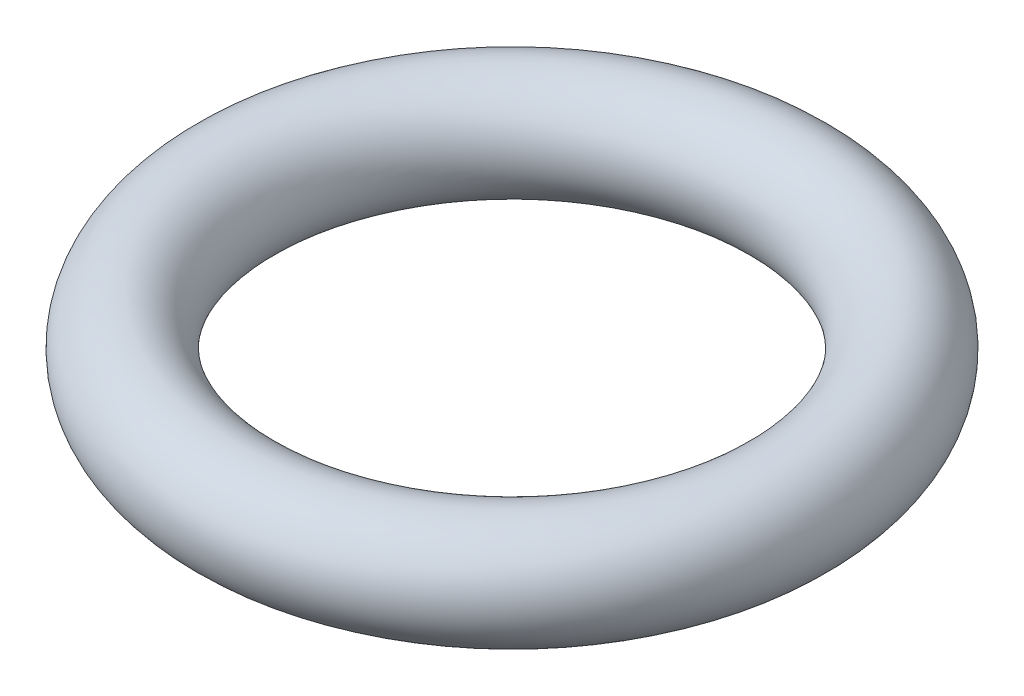
from build123d import *

# Parameters (mm, degrees)
SKETCH1_R = 1.31


with BuildPart() as part:
    # Sketch1 → Revolve1 (revolve)
    with BuildSketch(Plane.XY, mode=Mode.PRIVATE) as revolve1_sk:
        with Locations((-6.7, 0)):
            Circle(SKETCH1_R)
    revolve(revolve1_sk.sketch.rotate(Axis((0, 7.794551818, 0), (0, -1, 0)), 270), axis=Axis((0, 7.794551818, 0), (0, -1, 0)))


solid = part.part
